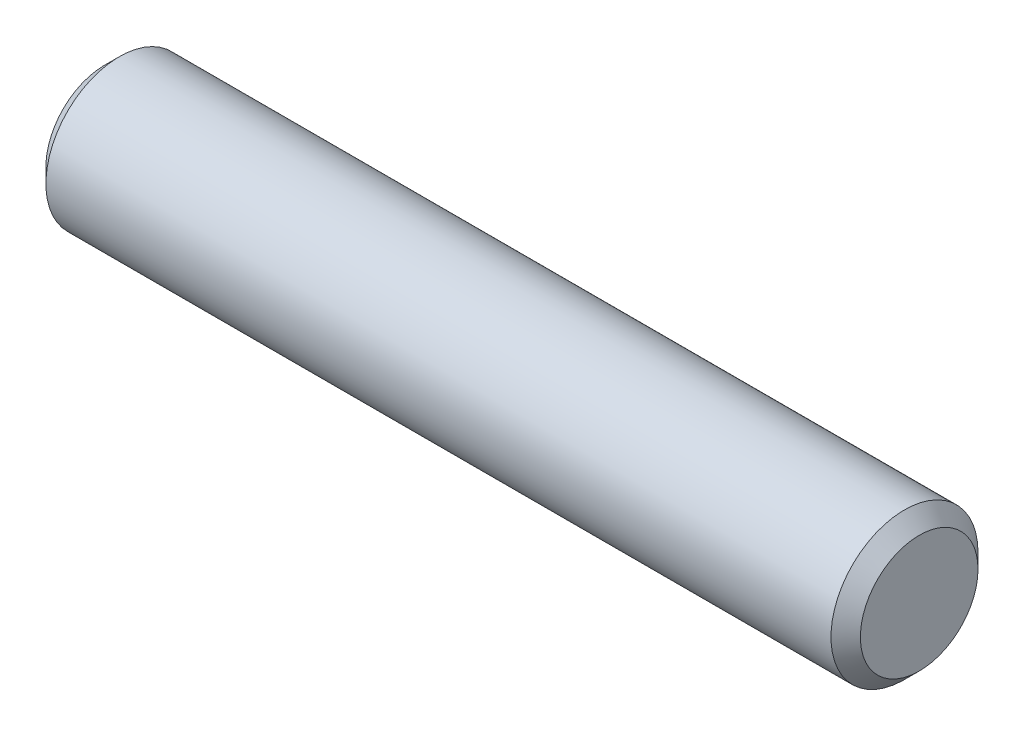
from build123d import *

# Parameters (mm, degrees)
SKETCH2_R           = 5
BOSS_EXTRUDE1_DEPTH = 55.4
CHAMFER1_SIZE       = 1


with BuildPart() as part:
    # Sketch2 → Boss-Extrude1 (new body)
    with BuildSketch(Plane(origin=(0, 0, 0), x_dir=(0, 0, -1), z_dir=(1, 0, 0))):
        Circle(SKETCH2_R)
    extrude(amount=BOSS_EXTRUDE1_DEPTH)

    # Chamfer1
    chamfer1_edges = [part.edges().sort_by_distance(p)[0] for p in [
        (0, 0, 5),
        (55.4, 0, 5),
    ]]
    chamfer(chamfer1_edges, length=CHAMFER1_SIZE)


solid = part.part
